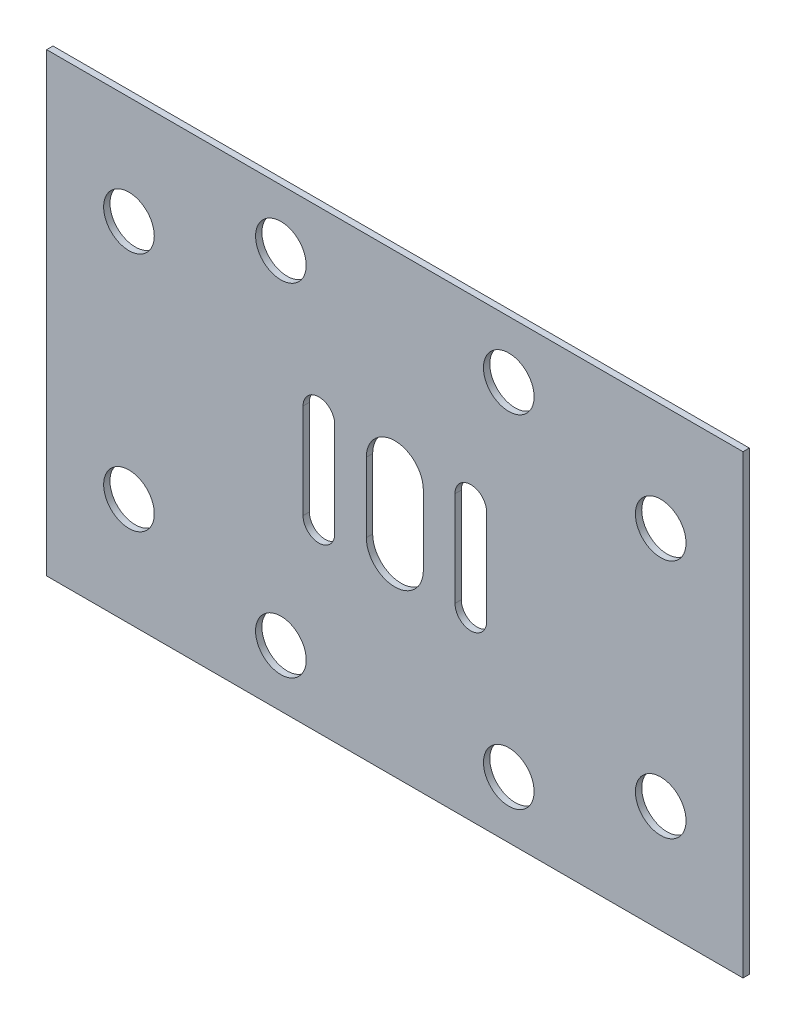
from build123d import *

# Parameters (mm, degrees)
SKETCH1_W           = 55
SKETCH1_H           = 36
SKETCH1_R           = 2
BOSS_EXTRUDE1_DEPTH = 0.25


with BuildPart() as part:
    # Sketch1 → Boss-Extrude1 (new, symmetric)
    with BuildSketch(Plane.XY):
        Rectangle(SKETCH1_W, SKETCH1_H)
        with Locations((-9, 13.5)):
            Circle(SKETCH1_R, mode=Mode.SUBTRACT)
        with Locations((-21, 9.5)):
            Circle(SKETCH1_R, mode=Mode.SUBTRACT)
        with Locations(Location((-9, -13.5, 0), (0, 0, 180))):
            Circle(SKETCH1_R, mode=Mode.SUBTRACT)
        with Locations(Location((-21, -9.5, 0), (0, 0, 180))):
            Circle(SKETCH1_R, mode=Mode.SUBTRACT)
        with Locations((9, -13.5)):
            Circle(SKETCH1_R, mode=Mode.SUBTRACT)
        with Locations((21, -9.5)):
            Circle(SKETCH1_R, mode=Mode.SUBTRACT)
        with Locations(Location((9, 13.5, 0), (0, 0, 180))):
            Circle(SKETCH1_R, mode=Mode.SUBTRACT)
        with Locations(Location((21, 9.5, 0), (0, 0, 180))):
            Circle(SKETCH1_R, mode=Mode.SUBTRACT)
        with BuildLine():
            Line((2.25, 2.75), (2.25, -2.75))
            ThreePointArc((2.25, -2.75), (0, -5), (-2.25, -2.75))
            Line((-2.25, -2.75), (-2.25, 2.75))
            ThreePointArc((-2.25, 2.75), (0, 5), (2.25, 2.75))
        make_face(mode=Mode.SUBTRACT)
        with BuildLine():
            Line((-4.75, 3.75), (-4.75, -3.75))
            ThreePointArc((-4.75, -3.75), (-6, -5), (-7.25, -3.75))
            Line((-7.25, -3.75), (-7.25, 3.75))
            ThreePointArc((-7.25, 3.75), (-6, 5), (-4.75, 3.75))
        make_face(mode=Mode.SUBTRACT)
        with BuildLine():
            Line((4.75, 3.75), (4.75, -3.75))
            ThreePointArc((4.75, -3.75), (6, -5), (7.25, -3.75))
            Line((7.25, -3.75), (7.25, 3.75))
            ThreePointArc((7.25, 3.75), (6, 5), (4.75, 3.75))
        make_face(mode=Mode.SUBTRACT)
    extrude(amount=BOSS_EXTRUDE1_DEPTH, both=True)


solid = part.part
